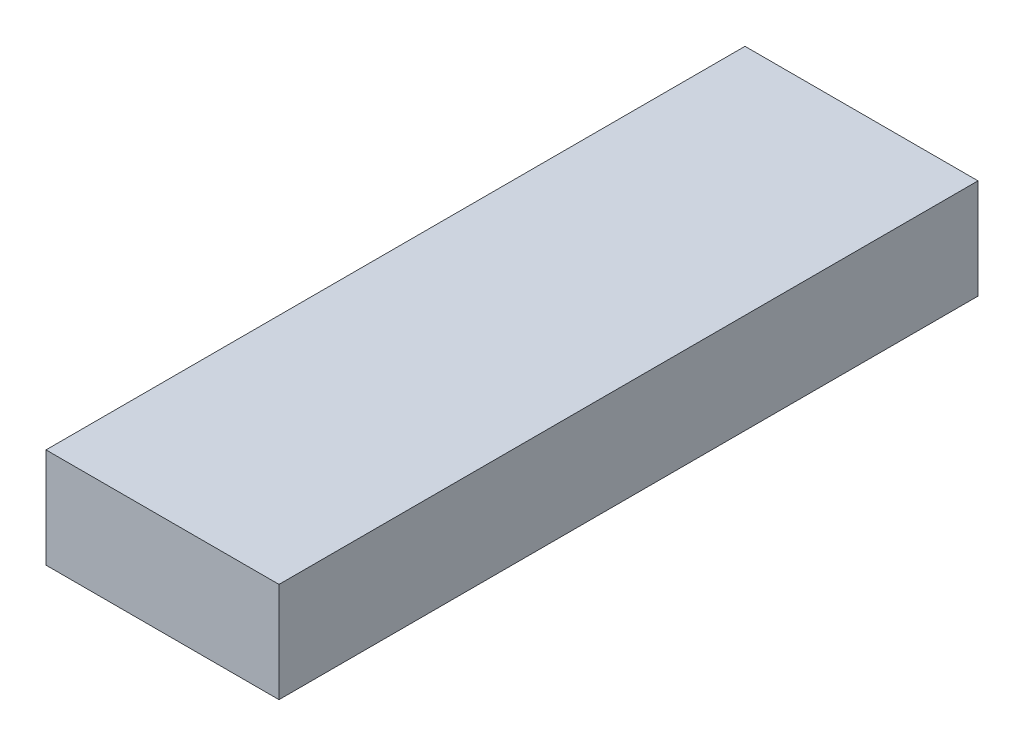
from build123d import *

# Parameters (mm, degrees)
CROQUIS1_W              = 7
CROQUIS1_H              = 3
SALIENTE_EXTRUIR1_DEPTH = 21


with BuildPart() as part:
    # Croquis1 → Saliente-Extruir1 (new body)
    with BuildSketch(Plane.XY):
        with Locations((3.5, 1.5)):
            Rectangle(CROQUIS1_W, CROQUIS1_H)
    extrude(amount=SALIENTE_EXTRUIR1_DEPTH)


solid = part.part
